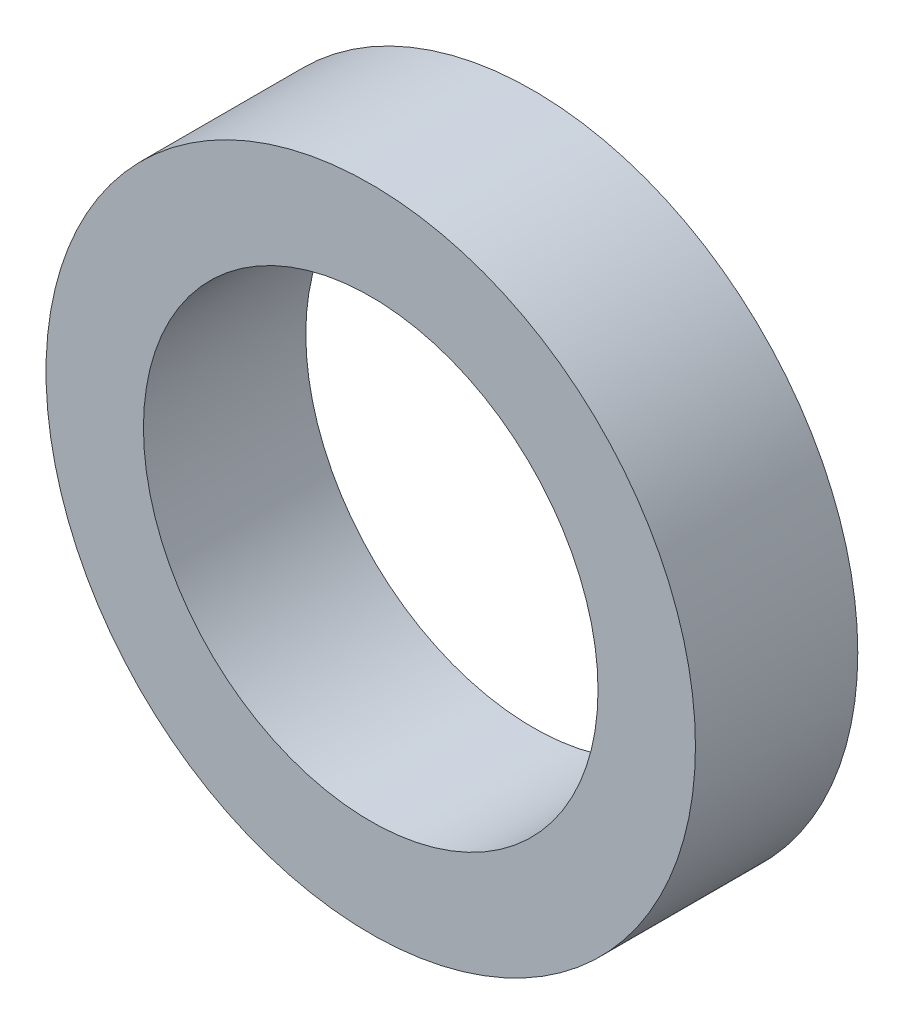
from build123d import *

# Parameters (mm, degrees)
SKETCH1_R           = 10
SKETCH1_R_2         = 7
BOSS_EXTRUDE1_DEPTH = 5


with BuildPart() as part:
    # Sketch1 → Boss-Extrude1 (new body)
    with BuildSketch(Plane.XY):
        Circle(SKETCH1_R)
        Circle(SKETCH1_R_2, mode=Mode.SUBTRACT)
    extrude(amount=BOSS_EXTRUDE1_DEPTH)


solid = part.part
